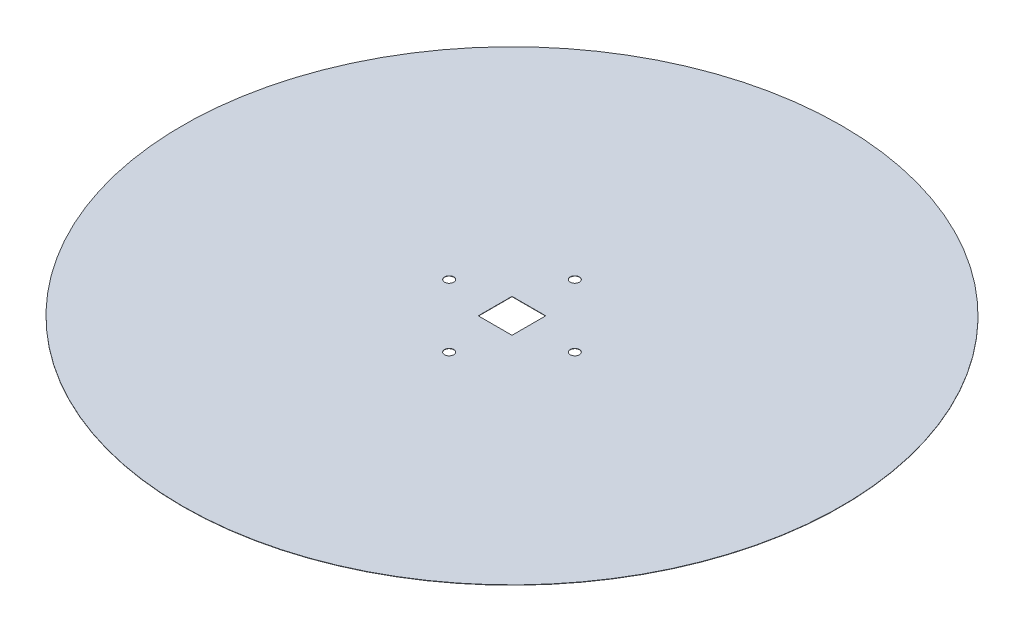
from build123d import *

# Parameters (mm, degrees)
SKETCH_1_R          = 215
EXTRUDE_1_DEPTH     = 0.2
CUT_EXTRUDE_2_REACH = 306.056
SKETCH_4_R          = 3
SKETCH_4_W          = 22
SKETCH_4_H          = 22


with BuildPart() as part:
    # Эскиз1 → Бобышка-Вытянуть1 (new body)
    with BuildSketch(Plane(origin=(0, 0, 0), x_dir=(1, 0, 0), z_dir=(0, 1, 0))):
        with Locations(Location((0, 0, 0), (0, 0, 270))):
            Circle(SKETCH_1_R)
    extrude(amount=EXTRUDE_1_DEPTH)

    # Эскиз4 → Вырез-Вытянуть2 (cut, up to next)
    with BuildSketch(Plane(origin=(0, 0.2, 0), x_dir=(1, 0, 0), z_dir=(0, 1, 0)), mode=Mode.PRIVATE) as cut_extrude_2_sk1:
        with Locations(Location((0, 41, 0), (0, 0, 270))):
            Circle(SKETCH_4_R)
    cut_extrude_2_tool1 = extrude(cut_extrude_2_sk1.sketch, amount=-CUT_EXTRUDE_2_REACH, mode=Mode.PRIVATE) & part.part
    # Эскиз4 → Вырез-Вытянуть2 (cut, up to next)
    with BuildSketch(Plane(origin=(0, 0.2, 0), x_dir=(1, 0, 0), z_dir=(0, 1, 0)), mode=Mode.PRIVATE) as cut_extrude_2_sk2:
        with Locations(Location((41, 0, 0), (0, 0, 270))):
            Circle(SKETCH_4_R)
    cut_extrude_2_tool2 = extrude(cut_extrude_2_sk2.sketch, amount=-CUT_EXTRUDE_2_REACH, mode=Mode.PRIVATE) & part.part
    # Эскиз4 → Вырез-Вытянуть2 (cut, up to next)
    with BuildSketch(Plane(origin=(0, 0.2, 0), x_dir=(1, 0, 0), z_dir=(0, 1, 0)), mode=Mode.PRIVATE) as cut_extrude_2_sk3:
        with Locations(Location((0, -41, 0), (0, 0, 270))):
            Circle(SKETCH_4_R)
    cut_extrude_2_tool3 = extrude(cut_extrude_2_sk3.sketch, amount=-CUT_EXTRUDE_2_REACH, mode=Mode.PRIVATE) & part.part
    # Эскиз4 → Вырез-Вытянуть2 (cut, up to next)
    with BuildSketch(Plane(origin=(0, 0.2, 0), x_dir=(1, 0, 0), z_dir=(0, 1, 0)), mode=Mode.PRIVATE) as cut_extrude_2_sk4:
        with Locations(Location((-41, 0, 0), (0, 0, 270))):
            Circle(SKETCH_4_R)
    cut_extrude_2_tool4 = extrude(cut_extrude_2_sk4.sketch, amount=-CUT_EXTRUDE_2_REACH, mode=Mode.PRIVATE) & part.part
    # Эскиз4 → Вырез-Вытянуть2 (cut, up to next)
    with BuildSketch(Plane(origin=(0, 0.2, 0), x_dir=(1, 0, 0), z_dir=(0, 1, 0)), mode=Mode.PRIVATE) as cut_extrude_2_sk5:
        Rectangle(SKETCH_4_W, SKETCH_4_H)
    cut_extrude_2_tool5 = extrude(cut_extrude_2_sk5.sketch, amount=-CUT_EXTRUDE_2_REACH, mode=Mode.PRIVATE) & part.part
    add(cut_extrude_2_tool1.solids().sort_by_distance((0, 0.2, -41))[0], mode=Mode.SUBTRACT)
    add(cut_extrude_2_tool2.solids().sort_by_distance((41, 0.2, 0))[0], mode=Mode.SUBTRACT)
    add(cut_extrude_2_tool3.solids().sort_by_distance((0, 0.2, 41))[0], mode=Mode.SUBTRACT)
    add(cut_extrude_2_tool4.solids().sort_by_distance((-41, 0.2, 0))[0], mode=Mode.SUBTRACT)
    add(cut_extrude_2_tool5.solids().sort_by_distance((0, 0.2, 0))[0], mode=Mode.SUBTRACT)


solid = part.part
